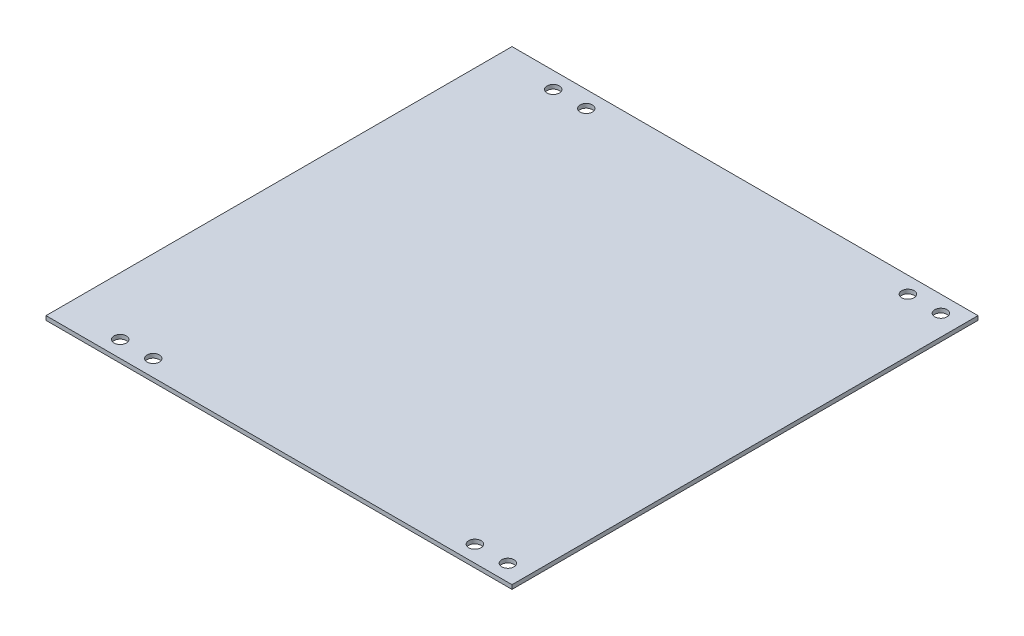
from build123d import *

# Parameters (mm, degrees)
SKETCH1_W           = 358.775
SKETCH1_H           = 358.775
BOSS_EXTRUDE1_DEPTH = 3.175
SKETCH2_R           = 4.7625
CUT_EXTRUDE1_DEPTH  = 508.394404655


with BuildPart() as part:
    # Sketch1 → Boss-Extrude1 (new body)
    with BuildSketch(Plane(origin=(0, 0, 0), x_dir=(1, 0, 0), z_dir=(0, 1, 0))):
        with Locations((179.3875, 179.3875)):
            Rectangle(SKETCH1_W, SKETCH1_H)
    extrude(amount=BOSS_EXTRUDE1_DEPTH)

    # Sketch2 → Cut-Extrude1 (cut, through all)
    with BuildSketch(Plane(origin=(0, 3.175, 0), x_dir=(1, 0, 0), z_dir=(0, 1, 0))):
        with Locations(Location((44.45, 12.7, 0), (0, 0, 270))):
            Circle(SKETCH2_R)
        with Locations(Location((69.85, 12.7, 0), (0, 0, 270))):
            Circle(SKETCH2_R)
        with Locations(Location((317.5, 12.7, 0), (0, 0, 270))):
            Circle(SKETCH2_R)
        with Locations(Location((342.9, 12.7, 0), (0, 0, 270))):
            Circle(SKETCH2_R)
    cut_extrude1 = extrude(amount=-CUT_EXTRUDE1_DEPTH, mode=Mode.SUBTRACT)

    # Mirror1: Cut-Extrude1 across plane
    add(cut_extrude1.mirror(Plane.XY.offset(-179.3875)), mode=Mode.SUBTRACT)


solid = part.part
